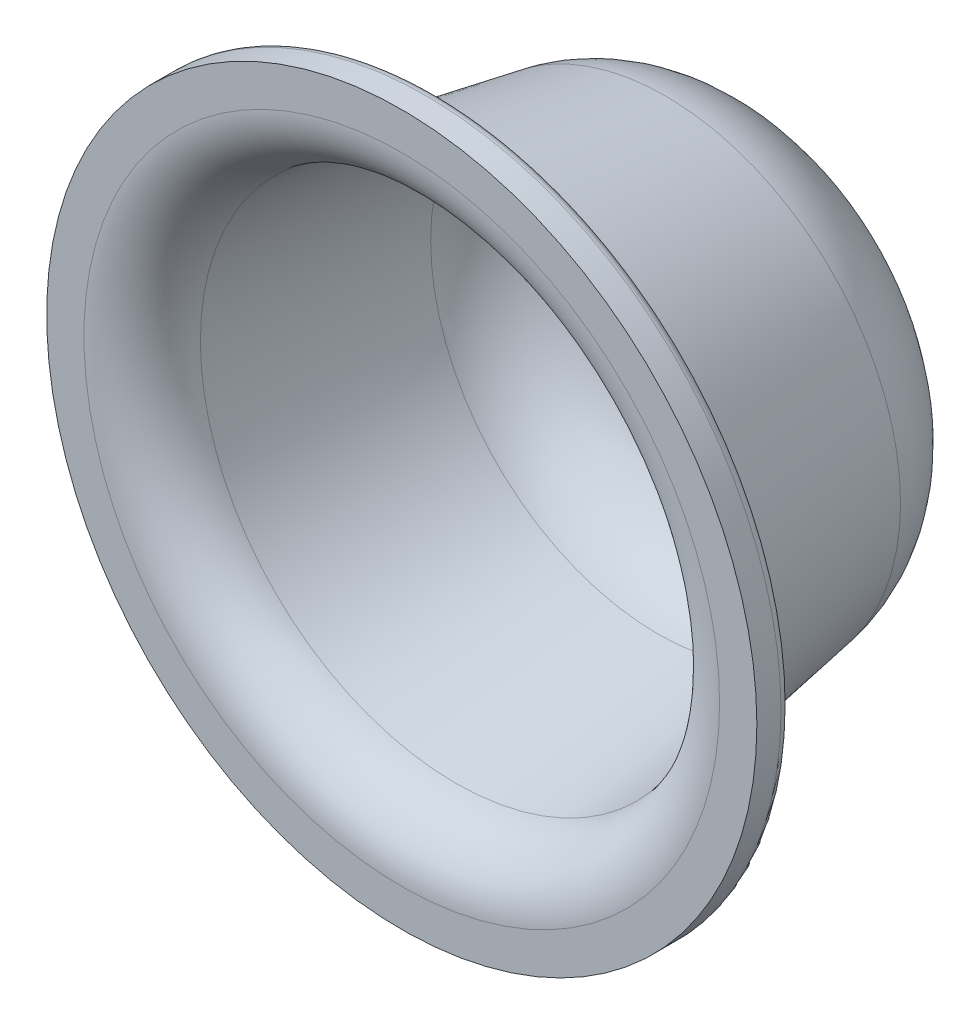
from build123d import *


with BuildPart() as part:
    # Sketch1 → Revolve1 (revolve)
    with BuildSketch(Plane(origin=(0, 0, 0), x_dir=(0, 0, -1), z_dir=(1, 0, 0)), mode=Mode.PRIVATE) as revolve1_sk:
        with BuildLine():
            Line((0, 50), (3.4, 50))
            ThreePointArc((3.4, 50), (4.8, 48.6), (3.4, 47.2))
            Line((3.4, 47.2), (3.2, 47.2))
            ThreePointArc((3.2, 47.2), (2.492893219, 46.907106781), (2.2, 46.2))
            Line((2.2, 46.2), (2.2, 44.3))
            ThreePointArc((2.2, 44.3), (3.603733341, 40.443274342), (7.158110934, 38.391153482))
            Line((7.158110934, 38.391153482), (37.125667198, 33.107064767))
            ThreePointArc((37.125667198, 33.107064767), (47.788799976, 26.950702187), (52, 15.380525212))
            Line((52, 15.380525212), (52, 0))
            Line((52, 0), (48.15, 0))
            Line((48.15, 0), (48.15, 18.15))
            ThreePointArc((48.15, 18.15), (44.711147764, 27.340329586), (36.083977442, 32.015775537))
            Line((36.083977442, 32.015775537), (7.627449974, 35.984849035))
            ThreePointArc((7.627449974, 35.984849035), (2.173845878, 38.940398797), (0, 44.75))
            Line((0, 44.75), (0, 50))
        make_face()
    revolve(revolve1_sk.sketch.rotate(Axis((0, 0, 0), (0, 0, -1)), 90), axis=Axis((0, 0, 0), (0, 0, -1)))


solid = part.part
